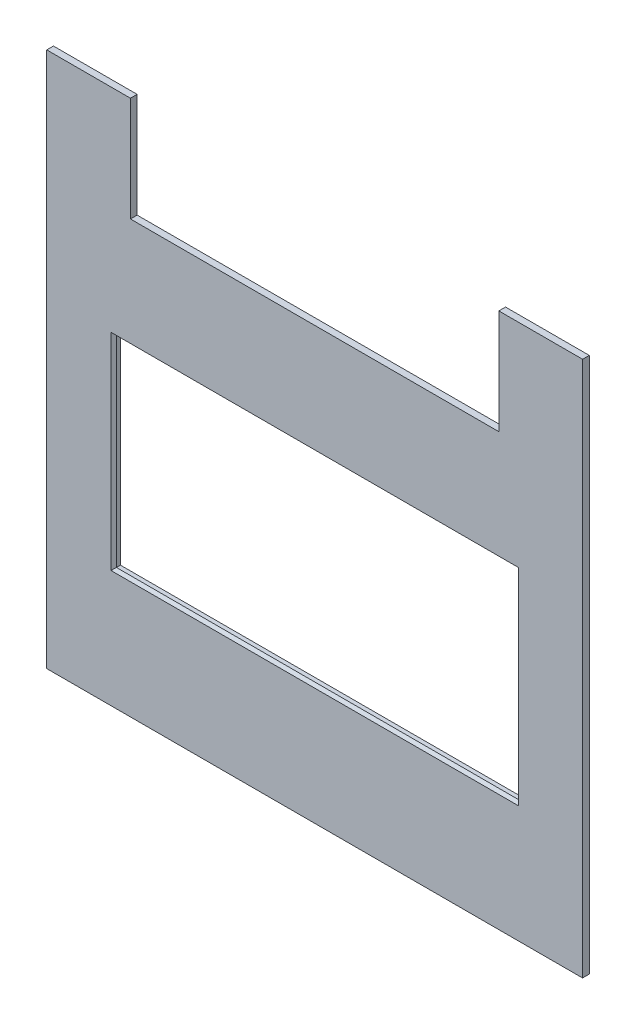
from build123d import *

# Parameters (mm, degrees)
ESQUISSE1_W             = 400
ESQUISSE1_H             = 400
BOSS_EXTRU_1_DEPTH      = 5
ESQUISSE2_W             = 300
ESQUISSE2_H             = 150.02
ENL_V_MAT_EXTRU_1_DEPTH = 10
CHANFREIN1_SIZE         = 2
ESQUISSE3_W             = 275
ESQUISSE3_H             = 78.068424488
ENL_V_MAT_EXTRU_2_DEPTH = 283.886903196


with BuildPart() as part:
    # Esquisse1 → Boss.-Extru.1 (new body)
    with BuildSketch(Plane.XY):
        Rectangle(ESQUISSE1_W, ESQUISSE1_H)
    extrude(amount=BOSS_EXTRU_1_DEPTH)

    # Esquisse2 → Enlèv. mat.-Extru.1 (cut)
    with BuildSketch(Plane.XY.offset(5)):
        with Locations((0, -35.58)):
            Rectangle(ESQUISSE2_W, ESQUISSE2_H)
    extrude(amount=-ENL_V_MAT_EXTRU_1_DEPTH, mode=Mode.SUBTRACT)

    # Chanfrein1
    chanfrein1_edges = [part.edges().sort_by_distance(p)[0] for p in [
        (150, -35.58, 5),
        (0, 39.43, 5),
        (-150, -35.58, 5),
        (0, -110.59, 5),
    ]]
    chamfer(chanfrein1_edges, length=CHANFREIN1_SIZE)

    # Esquisse3 → Enlèv. mat.-Extru.2 (cut, through all)
    with BuildSketch(Plane.XY.offset(5)):
        with Locations((0, 160.965787756)):
            Rectangle(ESQUISSE3_W, ESQUISSE3_H)
    extrude(amount=-ENL_V_MAT_EXTRU_2_DEPTH, mode=Mode.SUBTRACT)


solid = part.part
